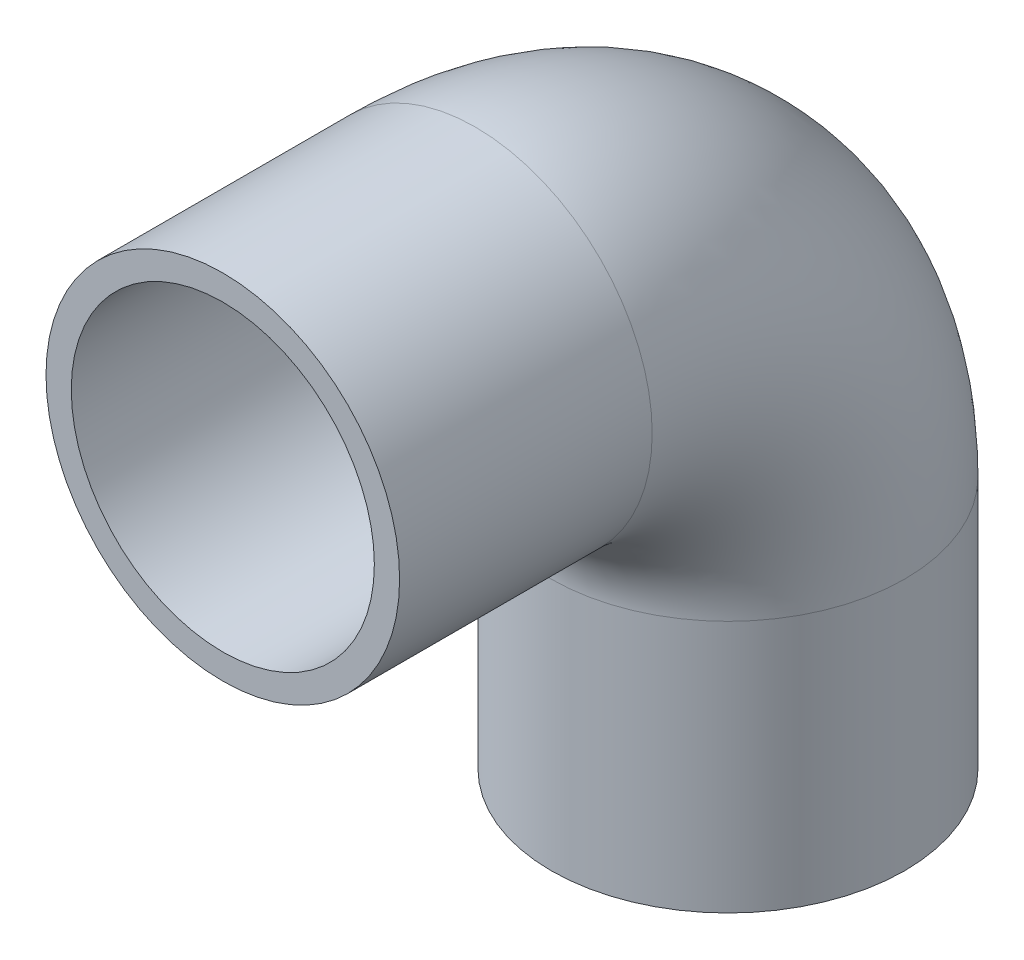
from build123d import *

# Parameters (mm, degrees)
SKETCH_1_R = 7
SKETCH_3_R = 6


with BuildPart() as part:
    # Sweep 1: sweep along a path in 草图2
    with BuildLine(Plane(origin=(0, 0, 0), x_dir=(0, 0, -1), z_dir=(1, 0, 0))) as sweep_1_path:
        Line((0, 0), (10, 0))
        ThreePointArc((10, 0), (17.071067812, -2.928932188), (20, -10))
        Line((20, -10), (20, -20))
    # 草图1 → Sweep 1 (sweep)
    with BuildSketch(Plane.XY):
        Circle(SKETCH_1_R)
    sweep(path=sweep_1_path.line)

    # Sweep 1 2: sweep along a path in 草图4
    with BuildLine(Plane(origin=(0, 0, 0), x_dir=(0, 0, -1), z_dir=(1, 0, 0))) as sweep_1_2_path:
        Line((0, 0), (10, 0))
        ThreePointArc((10, 0), (17.071067812, -2.928932188), (20, -10))
        Line((20, -10), (20, -20))
    # 草图3 → Sweep 1 2 (sweep, cut)
    with BuildSketch(Plane.XY):
        Circle(SKETCH_3_R)
    sweep(path=sweep_1_2_path.line, mode=Mode.SUBTRACT)


solid = part.part
